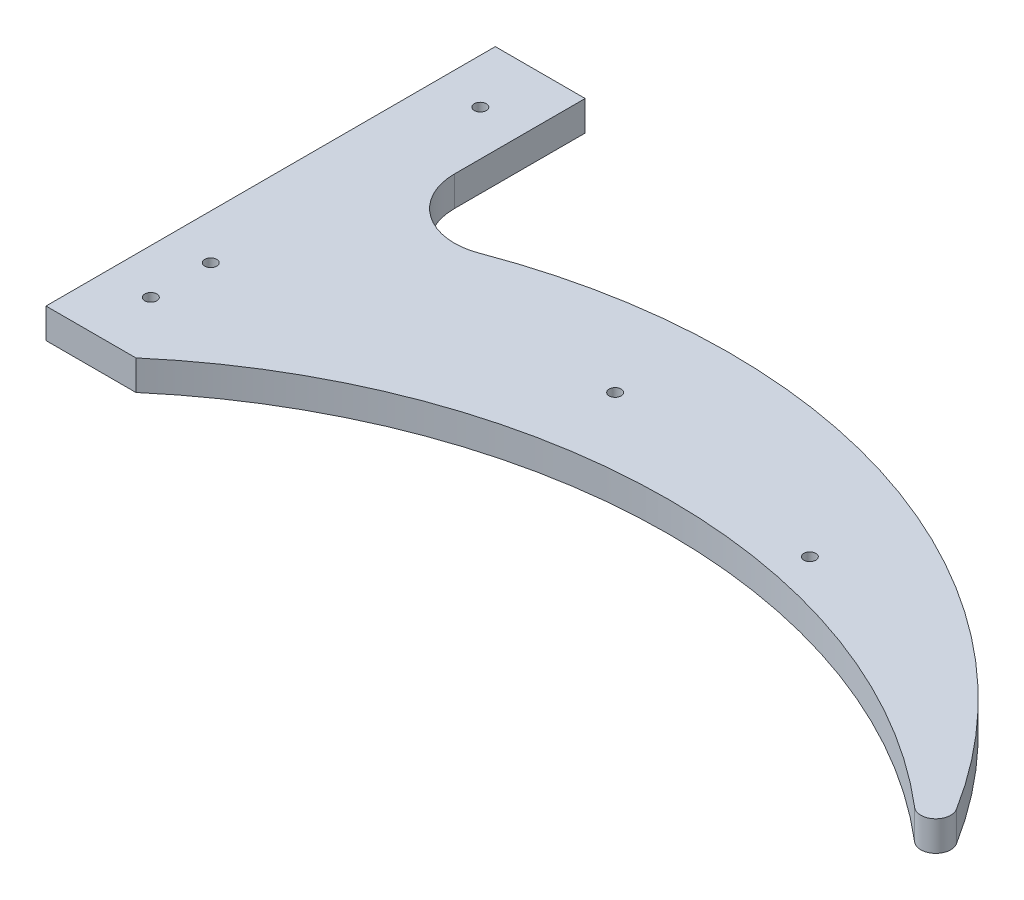
from build123d import *

# Parameters (mm, degrees)
SKETCH1_R           = 1
BOSS_EXTRUDE1_DEPTH = 5


with BuildPart() as part:
    # Sketch1 → Boss-Extrude1 (new body)
    with BuildSketch(Plane(origin=(0, 0, 0), x_dir=(1, 0, 0), z_dir=(0, 1, 0))):
        with BuildLine():
            Line((0, 75), (0, 53.165914195))
            ThreePointArc((0, 53.165914195), (4.315565807, 44.938690611), (13.537441581, 43.812491984))
            ThreePointArc((13.537441581, 43.812491984), (80.9029452, 45.023033848), (133.74584981, 3.223465408))
            ThreePointArc((133.74584981, 3.223465408), (133.255689752, 0.004881448), (130, 0))
            ThreePointArc((130, 0), (65, 24.006579232), (0, 0))
            Line((0, 0), (-15, 0))
            Line((-15, 0), (-15, 75))
            Line((-15, 75), (0, 75))
        make_face()
        with Locations(Location((-7.5, 10, 0), (0, 0, 270))):
            Circle(SKETCH1_R, mode=Mode.SUBTRACT)
        with Locations(Location((-7.5, 20, 0), (0, 0, 270))):
            Circle(SKETCH1_R, mode=Mode.SUBTRACT)
        with Locations(Location((-7.5, 65, 0), (0, 0, 270))):
            Circle(SKETCH1_R, mode=Mode.SUBTRACT)
        with Locations(Location((85, 27.5, 0), (0, 0, 270))):
            Circle(SKETCH1_R, mode=Mode.SUBTRACT)
        with Locations(Location((45, 35, 0), (0, 0, 270))):
            Circle(SKETCH1_R, mode=Mode.SUBTRACT)
    extrude(amount=BOSS_EXTRUDE1_DEPTH)


solid = part.part
